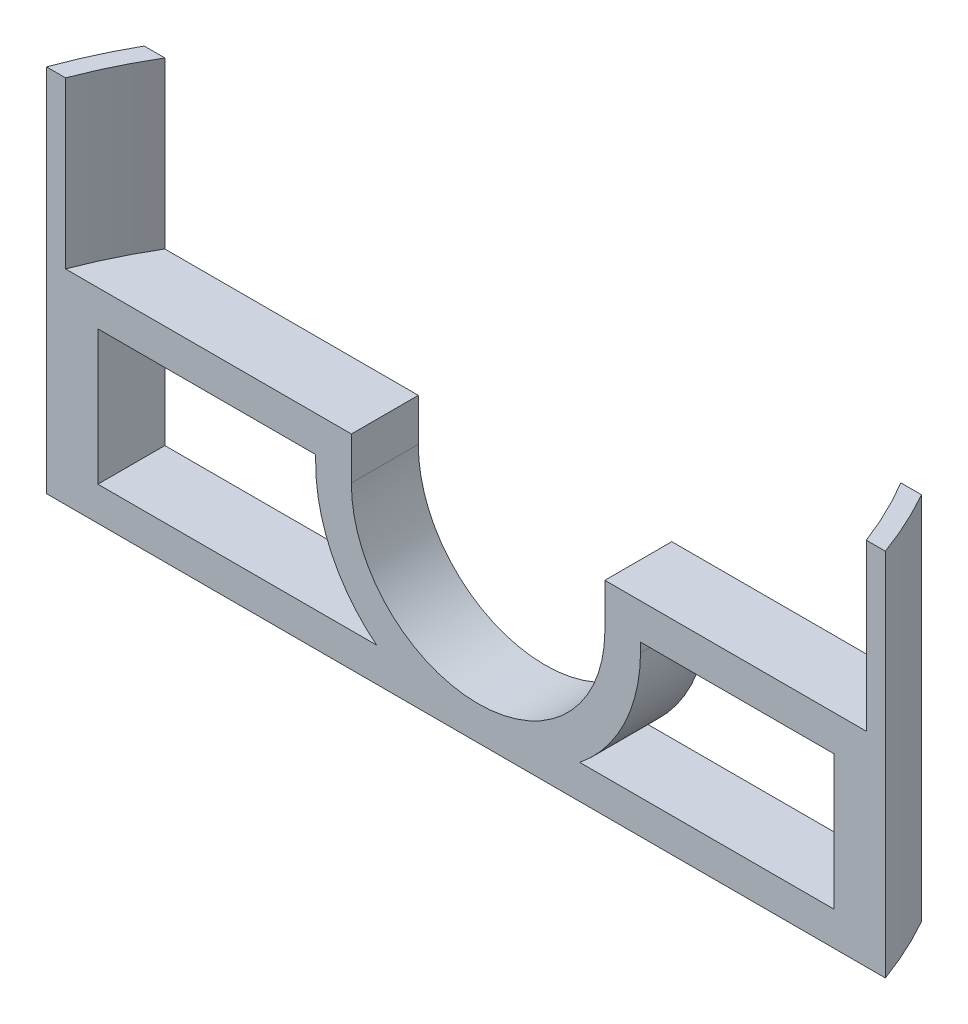
from build123d import *

# Parameters (mm, degrees)
BOSS_EXTRUDE1_DEPTH      = 7.5
BOSS_EXTRUDE2_DEPTH      = 18.54
BOSS_EXTRUDE2_DEPTH_BACK = 22.877829
CUT_EXTRUDE2_START       = -22.877828503
CUT_EXTRUDE2_DEPTH       = 22.877828503
CUT_EXTRUDE1_DEPTH       = 7.5


with BuildPart() as part:
    # Sketch2 → Boss-Extrude1 (new body)
    with BuildSketch(Plane.XY):
        with BuildLine():
            Line((75.649019024, 29.060438862), (108.081997982, 29.060438862))
            Line((108.081997982, 29.060438862), (108.081997982, 6.182610359))
            Line((108.081997982, 6.182610359), (12.081997982, 6.182610359))
            Line((12.081997982, 6.182610359), (12.081997982, 29.060438862))
            Line((12.081997982, 29.060438862), (47.250085178, 29.060438862))
            Line((47.250085178, 29.060438862), (47.250085178, 24.305651432))
            ThreePointArc((47.250085178, 24.305651432), (61.326511028, 9.983143436), (75.649019024, 24.059569287))
            Line((75.649019024, 24.059569287), (75.649019024, 29.060438862))
        make_face()
    extrude(amount=BOSS_EXTRUDE1_DEPTH)

    # Sketch7 → Boss-Extrude2 (add, two sides: drawn at the far end of the back side and taken through both)
    with BuildSketch(Plane(origin=(0, 29.060438862, 0), x_dir=(1, 0, 0), z_dir=(0, 1, 0)).offset(-BOSS_EXTRUDE2_DEPTH_BACK)):
        with BuildLine():
            Line((101.320347636, 0), (103.631986296, 0))
            ThreePointArc((103.631986296, 0), (105.511041931, -3.678722762), (107.080019787, -7.5))
            Line((107.080019787, -7.5), (104.946394262, -7.5))
            ThreePointArc((104.946394262, -7.5), (103.296384641, -3.6711873), (101.320347636, 0))
        make_face()
        with BuildLine():
            Line((18.843648328, 0), (16.532009668, 0))
            ThreePointArc((16.532009668, 0), (14.652954033, -3.678722762), (13.083976177, -7.5))
            Line((13.083976177, -7.5), (15.217601702, -7.5))
            ThreePointArc((15.217601702, -7.5), (16.867611323, -3.6711873), (18.843648328, 0))
        make_face()
    extrude(amount=BOSS_EXTRUDE2_DEPTH + BOSS_EXTRUDE2_DEPTH_BACK)

    # Sketch9 → Cut-Extrude2 (cut)
    with BuildSketch(Plane(origin=(0, 29.060438862, 0), x_dir=(1, 0, 0), z_dir=(0, 1, 0)).offset(CUT_EXTRUDE2_START)):
        with BuildLine():
            Line((108.081997982, 0), (103.631986296, 0))
            ThreePointArc((103.631986296, 0), (105.511041931, -3.678722762), (107.080019787, -7.5))
            Line((107.080019787, -7.5), (108.081997982, -7.5))
            Line((108.081997982, -7.5), (108.081997982, 0))
        make_face()
        with BuildLine():
            Line((12.081997982, -7.5), (13.083976177, -7.5))
            ThreePointArc((13.083976177, -7.5), (14.652954033, -3.678722762), (16.532009668, 0))
            Line((16.532009668, 0), (12.081997982, 0))
            Line((12.081997982, 0), (12.081997982, -7.5))
        make_face()
    extrude(amount=CUT_EXTRUDE2_DEPTH, mode=Mode.SUBTRACT)

    # Sketch8 → Cut-Extrude1 (cut)
    with BuildSketch(Plane.XY.offset(7.5)):
        with BuildLine():
            Line((18.843648328, 25.060438862), (18.843648328, 9.983143436))
            Line((18.843648328, 9.983143436), (50.064839288, 9.983143436))
            add(Edge.make_bspline(
                [(50.064839288, 9.983143436), (45.21005588, 13.875585407), (43.215886983, 19.247270307), (43.250085178, 24.305651432)],
                knots=[0.673696083, 0.673696083, 0.673696083, 0.673696083, 1, 1, 1, 1], degree=3, weights=[0.560759297, 0.636257623, 0.782671191, 1]))
            Line((43.250085178, 24.305651432), (43.250085178, 25.060438862))
            Line((43.250085178, 25.060438862), (18.843648328, 25.060438862))
        make_face()
        with BuildLine():
            Line((101.320347636, 9.983143436), (101.320347636, 25.060438862))
            Line((101.320347636, 25.060438862), (79.649019024, 25.060438862))
            Line((79.649019024, 25.060438862), (79.648868861, 24.02490983))
            add(Edge.make_bspline(
                [(79.648868861, 24.02490983), (79.605779212, 19.052181459), (77.595427824, 13.800428938), (72.83438207, 9.983143436)],
                knots=[0, 0, 0, 0, 0.321967204, 0.321967204, 0.321967204, 0.321967204], degree=3, weights=[1, 0.78555958, 0.640161942, 0.563807087]))
            Line((72.83438207, 9.983143436), (101.320347636, 9.983143436))
        make_face()
    extrude(amount=-CUT_EXTRUDE1_DEPTH, mode=Mode.SUBTRACT)


solid = part.part
